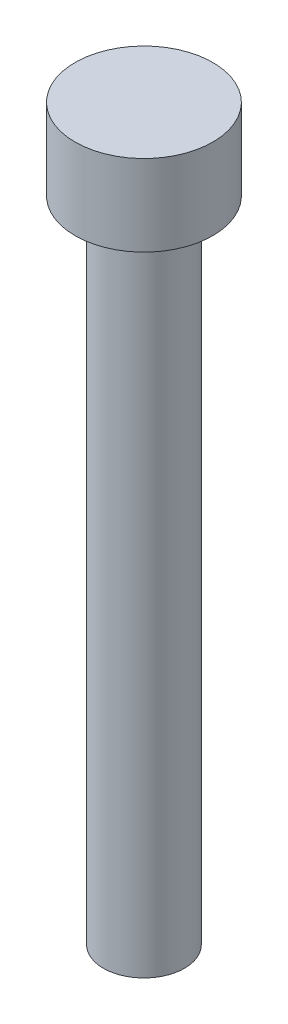
from build123d import *

# Parameters (mm, degrees)
SKETCH1_R           = 2.5
BOSS_EXTRUDE1_DEPTH = 40
SKETCH2_R           = 4.25
BOSS_EXTRUDE2_DEPTH = 5


with BuildPart() as part:
    # Sketch1 → Boss-Extrude1 (new body)
    with BuildSketch(Plane(origin=(0, 0, 0), x_dir=(1, 0, 0), z_dir=(0, 1, 0))):
        with Locations(Location((0, 0, 0), (0, 0, 270))):
            Circle(SKETCH1_R)
    extrude(amount=BOSS_EXTRUDE1_DEPTH)

    # Sketch2 → Boss-Extrude2 (add)
    with BuildSketch(Plane(origin=(0, 40, 0), x_dir=(1, 0, 0), z_dir=(0, 1, 0))):
        with Locations(Location((0, 0, 0), (0, 0, 270))):
            Circle(SKETCH2_R)
    extrude(amount=BOSS_EXTRUDE2_DEPTH)


solid = part.part
